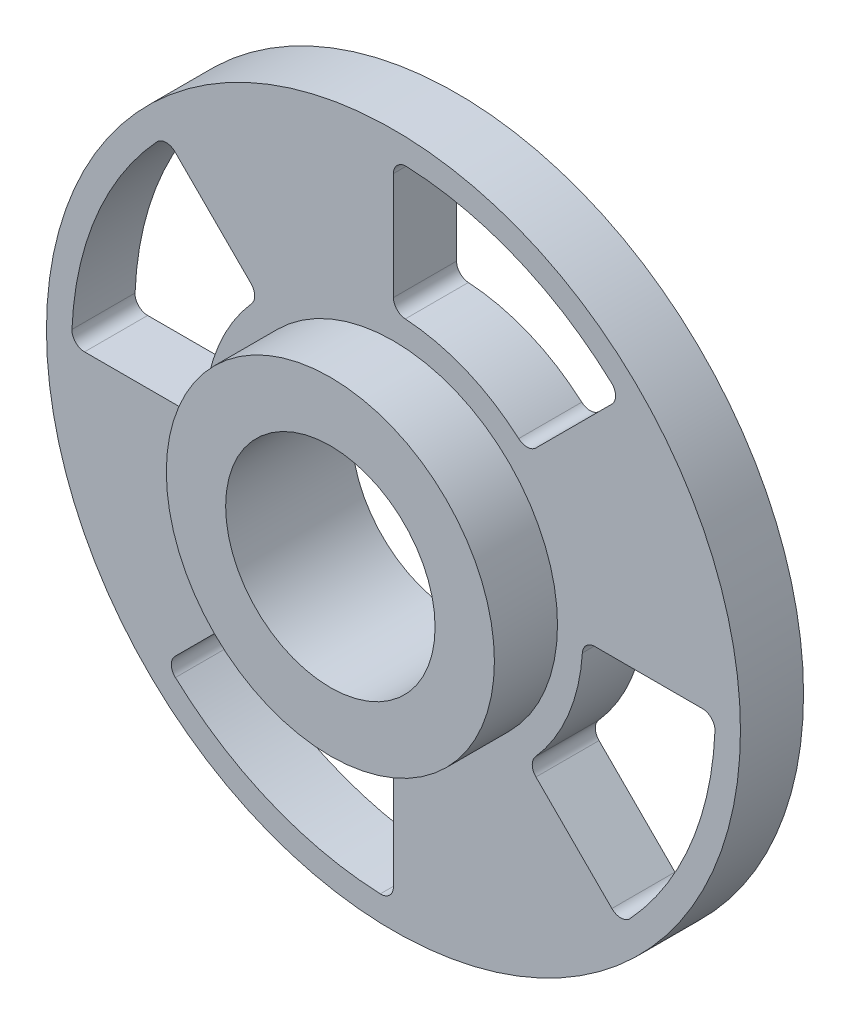
from build123d import *

# Parameters (mm, degrees)
SKETCH1_R                = 13.75
SKETCH1_R_2              = 4.15
BOSS_EXTRUDE1_DEPTH      = 2.5
SKETCH2_R                = 6.5
SKETCH2_R_2              = 4.15
BOSS_EXTRUDE2_DEPTH      = 2.5
CUT_EXTRUDE1_DEPTH       = 21.077973005
FILLET1_R                = 0.5
CIRPATTERN1_COUNT        = 4
FILLET1_OF_CIRPATTERN1_R = 0.5


with BuildPart() as part:
    # Sketch1 → Boss-Extrude1 (new body)
    with BuildSketch(Plane.XY):
        Circle(SKETCH1_R)
        Circle(SKETCH1_R_2, mode=Mode.SUBTRACT)
    extrude(amount=BOSS_EXTRUDE1_DEPTH)

    # Sketch2 → Boss-Extrude2 (add)
    with BuildSketch(Plane.XY.offset(2.5)):
        Circle(SKETCH2_R)
        Circle(SKETCH2_R_2, mode=Mode.SUBTRACT)
    extrude(amount=BOSS_EXTRUDE2_DEPTH)

    # Sketch5 → Cut-Extrude1 (cut, through all)
    with BuildSketch(Plane.XY):
        with BuildLine():
            Line((0, 12.75), (0, 7.5))
            ThreePointArc((0, 7.5), (2.870125743, 6.929096494), (5.303300859, 5.303300859))
            Line((5.303300859, 5.303300859), (9.01561146, 9.01561146))
            ThreePointArc((9.01561146, 9.01561146), (4.879213763, 11.77946404), (0, 12.75))
        make_face()
    cut_extrude1 = extrude(amount=CUT_EXTRUDE1_DEPTH, mode=Mode.SUBTRACT)

    # Fillet1
    fillet1_edges = [part.edges().sort_by_distance(p)[0] for p in [
        (0, 7.5, 1.25),
        (5.303300859, 5.303300859, 1.25),
        (9.01561146, 9.01561146, 1.25),
        (0, 12.75, 1.25),
    ]]
    fillet(fillet1_edges, radius=FILLET1_R)

    # CirPattern1: Cut-Extrude1 ×4 about axis
    cirpattern1_axis = Axis((0, 0, 0), (0, 0, 1))
    for i in range(1, CIRPATTERN1_COUNT):
        add(cut_extrude1.rotate(cirpattern1_axis, i * 360 / CIRPATTERN1_COUNT), mode=Mode.SUBTRACT)

    # Fillet1 of CirPattern1
    fillet1_of_cirpattern1_edges = [part.edges().sort_by_distance(p)[0] for p in [
        (-7.5, 0, 1.25),
        (-5.303300859, 5.303300859, 1.25),
        (-9.01561146, 9.01561146, 1.25),
        (-12.75, 0, 1.25),
        (0, -7.5, 1.25),
        (-5.303300859, -5.303300859, 1.25),
        (-9.01561146, -9.01561146, 1.25),
        (0, -12.75, 1.25),
        (7.5, 0, 1.25),
        (5.303300859, -5.303300859, 1.25),
        (9.01561146, -9.01561146, 1.25),
        (12.75, 0, 1.25),
    ]]
    fillet(fillet1_of_cirpattern1_edges, radius=FILLET1_OF_CIRPATTERN1_R)


solid = part.part
